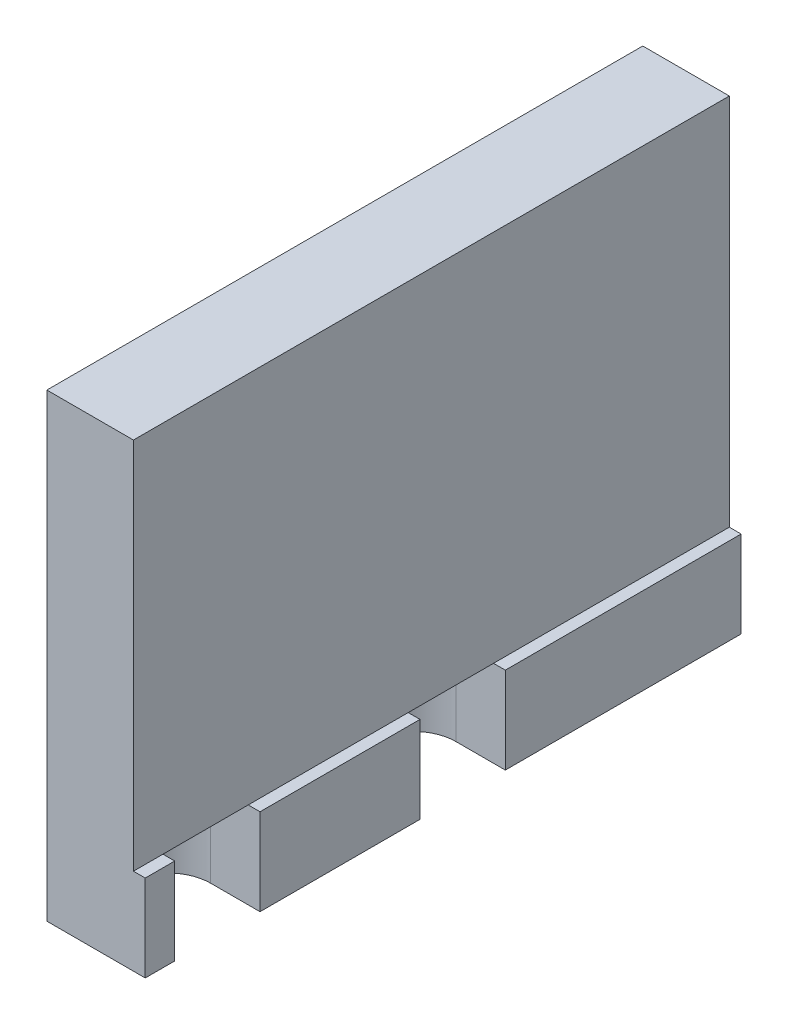
from build123d import *

# Parameters (mm, degrees)
BOSS_EXTRUDE1_DEPTH = 27
BOSS_EXTRUDE2_DEPTH = 14.3
CUT_EXTRUDE1_DEPTH  = 6
SKETCH4_W           = 6
SKETCH4_H           = 44.518768508
CUT_EXTRUDE2_DEPTH  = 66


with BuildPart() as part:
    # Sketch1 → Boss-Extrude1 (new body)
    with BuildSketch(Plane.XY):
        Polygon((0, 0), (-6.81828161, 0), (-6.81828161, 76.4), (-0.81828161, 76.4), (-0.81828161, 6), (0, 6), align=None)
    extrude(amount=BOSS_EXTRUDE1_DEPTH)

    # Sketch2 → Boss-Extrude2 (add)
    with BuildSketch(Plane(origin=(0, 0, 0), x_dir=(-1, 0, 0), z_dir=(0, 0, -1))):
        Polygon((0.81828161, 6), (0, 6), (0, 0), (6.81828161, 0), (6.81828161, 76.4), (0.81828161, 76.4), align=None)
    extrude(amount=BOSS_EXTRUDE2_DEPTH)

    # Sketch3 → Cut-Extrude1 (cut)
    with BuildSketch(Plane(origin=(0, 6, 0), x_dir=(1, 0, 0), z_dir=(0, 1, 0))):
        with BuildLine():
            Line((8.68171839, -2.04396728), (-3.41828161, -2.04396728))
            ThreePointArc((-3.41828161, -2.04396728), (-6.37431433, -5), (-3.41828161, -7.95603272))
            Line((-3.41828161, -7.95603272), (8.68171839, -7.95603272))
            ThreePointArc((8.68171839, -7.95603272), (11.63775111, -5), (8.68171839, -2.04396728))
        make_face()
        with BuildLine():
            Line((8.68171839, -19.04396728), (-3.41828161, -19.04396728))
            ThreePointArc((-3.41828161, -19.04396728), (-6.37431433, -22), (-3.41828161, -24.95603272))
            Line((-3.41828161, -24.95603272), (8.68171839, -24.95603272))
            ThreePointArc((8.68171839, -24.95603272), (11.63775111, -22), (8.68171839, -19.04396728))
        make_face()
    extrude(amount=-CUT_EXTRUDE1_DEPTH, mode=Mode.SUBTRACT)

    # Sketch4 → Cut-Extrude2 (cut)
    with BuildSketch(Plane(origin=(0, 0, -14.3), x_dir=(-1, 0, 0), z_dir=(0, 0, -1))):
        with Locations((3.81828161, 54.140615746)):
            Rectangle(SKETCH4_W, SKETCH4_H)
    extrude(amount=-CUT_EXTRUDE2_DEPTH, mode=Mode.SUBTRACT)


solid = part.part
